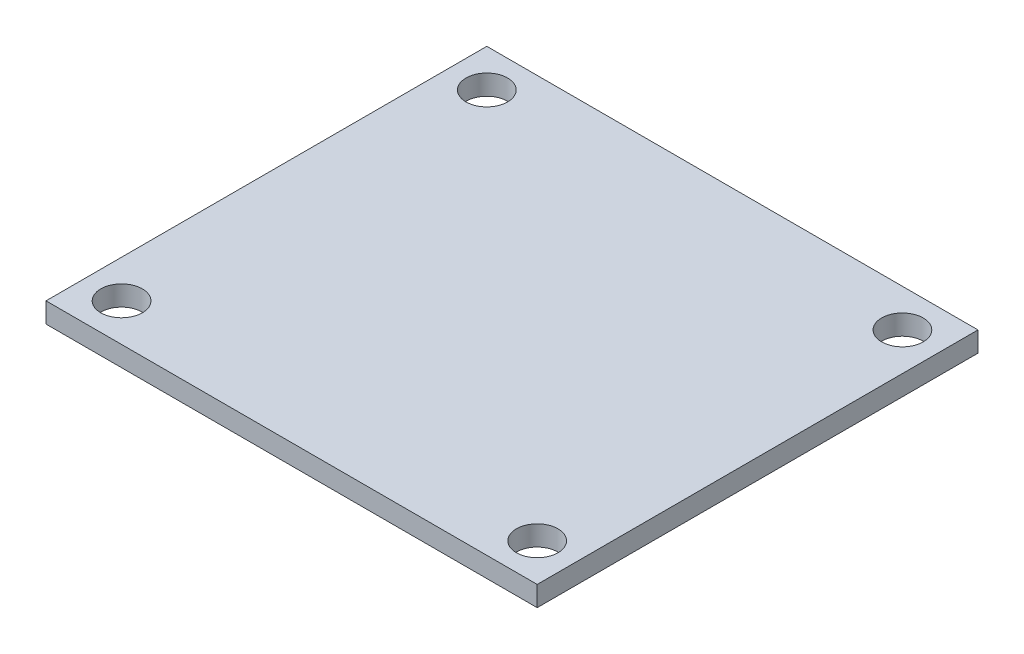
from build123d import *

# Parameters (mm, degrees)
SKETCH1_W           = 39
SKETCH1_H           = 35
SKETCH1_R           = 1.65
BOSS_EXTRUDE1_DEPTH = 1.6


with BuildPart() as part:
    # Sketch1 → Boss-Extrude1 (new body)
    with BuildSketch(Plane(origin=(0, 0, 0), x_dir=(1, 0, 0), z_dir=(0, 1, 0))):
        Rectangle(SKETCH1_W, SKETCH1_H)
        with Locations(Location((16.5, -14.5, 0), (0, 0, 270))):
            Circle(SKETCH1_R, mode=Mode.SUBTRACT)
        with Locations(Location((-16.5, -14.5, 0), (0, 0, 270))):
            Circle(SKETCH1_R, mode=Mode.SUBTRACT)
        with Locations(Location((-16.5, 14.5, 0), (0, 0, 270))):
            Circle(SKETCH1_R, mode=Mode.SUBTRACT)
        with Locations(Location((16.5, 14.5, 0), (0, 0, 270))):
            Circle(SKETCH1_R, mode=Mode.SUBTRACT)
    extrude(amount=BOSS_EXTRUDE1_DEPTH)


solid = part.part
